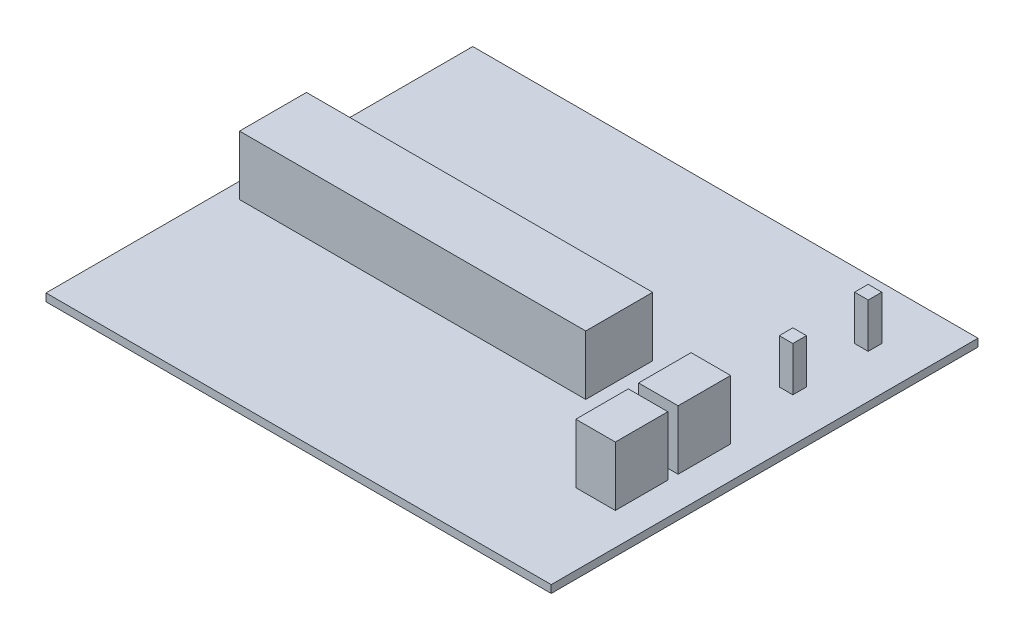
from build123d import *

# Parameters (mm, degrees)
SKETCH3_W           = 102.235
SKETCH3_H           = 86.36
BOSS_EXTRUDE1_DEPTH = 1.56
SKETCH4_W           = 70.061666
SKETCH4_H           = 13.546666
BOSS_EXTRUDE2_DEPTH = 12
SKETCH5_W           = 8
SKETCH5_H           = 10.625667
BOSS_EXTRUDE3_DEPTH = 12
SKETCH6_W           = 2.751667
SKETCH6_H           = 2.751667
BOSS_EXTRUDE4_DEPTH = 9


with BuildPart() as part:
    # Sketch3 → Boss-Extrude1 (new body)
    with BuildSketch(Plane(origin=(0, 0, 0), x_dir=(1, 0, 0), z_dir=(0, 1, 0))):
        with Locations((50.997852632, 42.807288421)):
            Rectangle(SKETCH3_W, SKETCH3_H)
    extrude(amount=BOSS_EXTRUDE1_DEPTH)

    # Sketch4 → Boss-Extrude2 (add)
    with BuildSketch(Plane(origin=(0, 1.56, 0), x_dir=(1, 0, 0), z_dir=(0, 1, 0))):
        with Locations((38.128519632, 42.341621421)):
            Rectangle(SKETCH4_W, SKETCH4_H)
    extrude(amount=BOSS_EXTRUDE2_DEPTH)

    # Sketch5 → Boss-Extrude3 (add)
    with BuildSketch(Plane(origin=(0, 1.56, 0), x_dir=(1, 0, 0), z_dir=(0, 1, 0))):
        with Locations((91.615352632, 37.113454921)):
            Rectangle(SKETCH5_W, SKETCH5_H)
        with Locations((91.615352632, 24.413454921)):
            Rectangle(SKETCH5_W, SKETCH5_H)
    extrude(amount=BOSS_EXTRUDE3_DEPTH)

    # Sketch6 → Boss-Extrude4 (add)
    with BuildSketch(Plane(origin=(0, 1.56, 0), x_dir=(1, 0, 0), z_dir=(0, 1, 0))):
        with Locations((91.934186132, 58.703454921)):
            Rectangle(SKETCH6_W, SKETCH6_H)
        with Locations((91.934186132, 73.943454921)):
            Rectangle(SKETCH6_W, SKETCH6_H)
    extrude(amount=BOSS_EXTRUDE4_DEPTH)


solid = part.part
